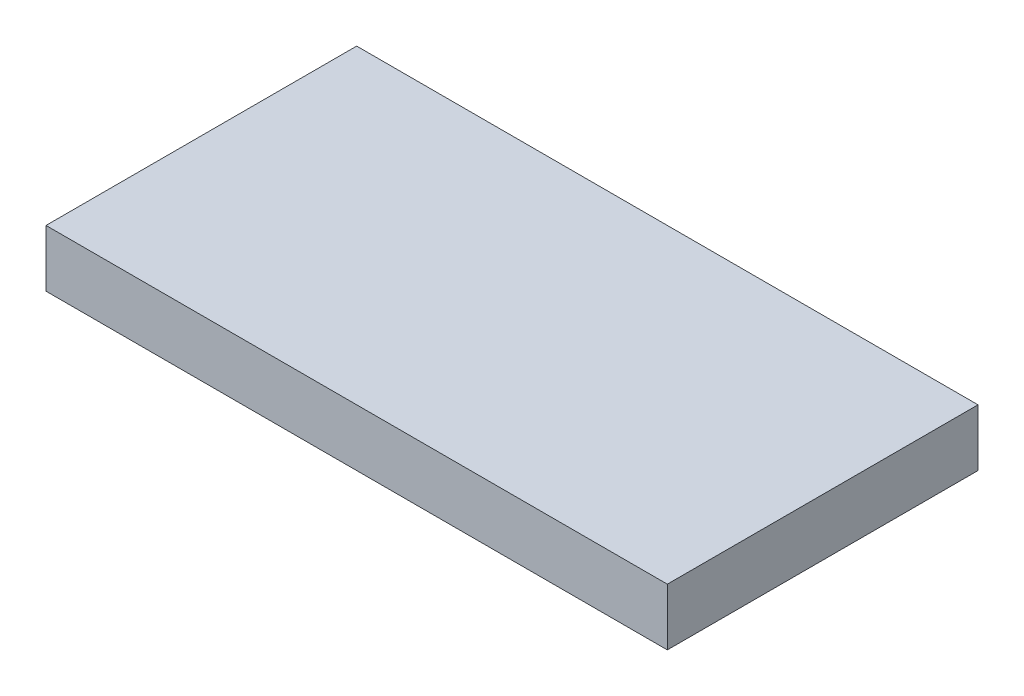
from build123d import *

# Parameters (mm, degrees)
SKETCH_1_W      = 600
SKETCH_1_H      = 300
EXTRUDE_1_DEPTH = 55


with BuildPart() as part:
    # 草图1 → 凸台-拉伸1 (new body)
    with BuildSketch(Plane(origin=(0, 0, 0), x_dir=(1, 0, 0), z_dir=(0, 1, 0))):
        with Locations((300, 150)):
            Rectangle(SKETCH_1_W, SKETCH_1_H)
    extrude(amount=EXTRUDE_1_DEPTH)


solid = part.part
